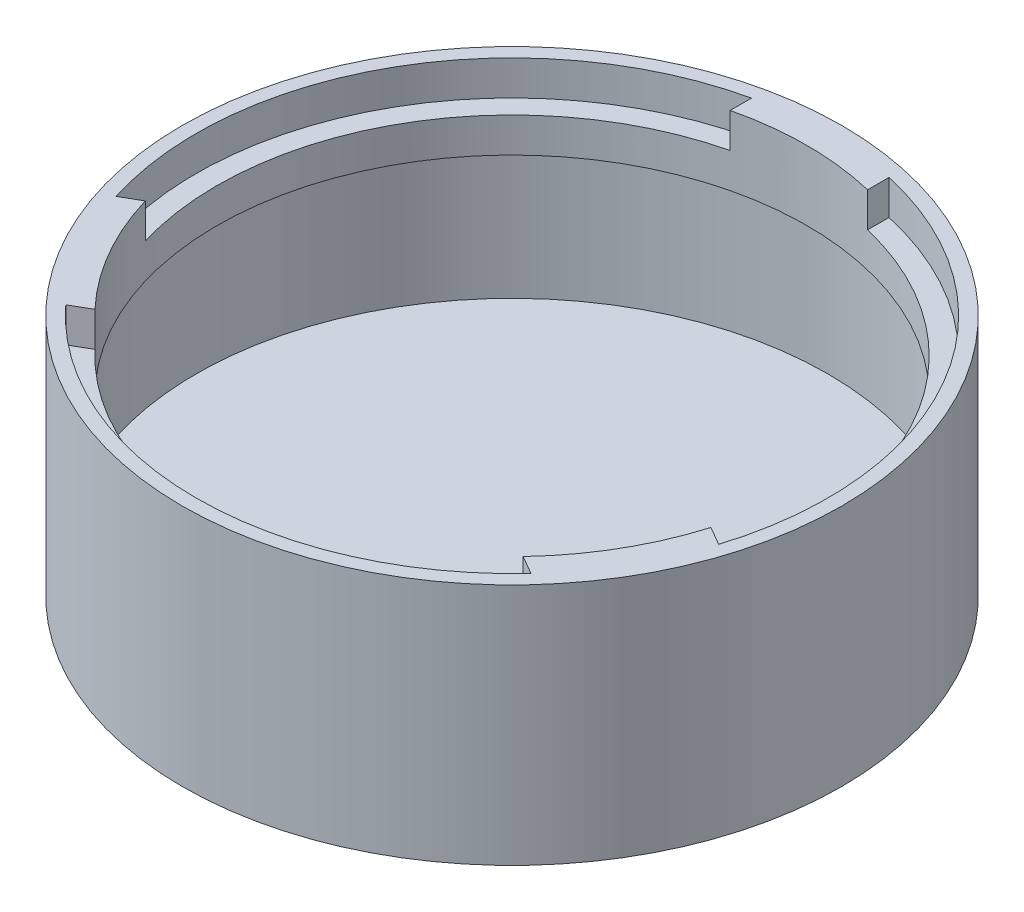
from build123d import *
from build123d.topology import SkipClean

# Parameters (mm, degrees)
CROQUIS1_R               = 95
SALIENTE_EXTRUIR1_DEPTH  = 10
CROQUIS3_R               = 95
CROQUIS3_R_2             = 91
SALIENTE_EXTRUIR2_DEPTH  = 60
SALIENTE_EXTRUIR10_DEPTH = 10
SALIENTE_EXTRUIR15_START = -10
CROQUIS7_R               = 91
CROQUIS7_R_2             = 85
SALIENTE_EXTRUIR15_DEPTH = 10


with BuildPart() as part:
    # Croquis1 → Saliente-Extruir1 (new body)
    with BuildSketch(Plane(origin=(0, 0, 0), x_dir=(1, 0, 0), z_dir=(0, 1, 0))):
        with Locations(Location((0, 0, 0), (0, 0, 270))):
            Circle(CROQUIS1_R)
    extrude(amount=SALIENTE_EXTRUIR1_DEPTH)

    # Croquis3 → Saliente-Extruir2 (add)
    with BuildSketch(Plane(origin=(0, 10, 0), x_dir=(1, 0, 0), z_dir=(0, 1, 0))):
        with Locations(Location((0, 0, 0), (0, 0, 270))):
            Circle(CROQUIS3_R)
        with Locations(Location((0, 0, 0), (0, 0, 270))):
            Circle(CROQUIS3_R_2, mode=Mode.SUBTRACT)
    extrude(amount=SALIENTE_EXTRUIR2_DEPTH)

    # Croquis4 → Saliente-Extruir10 (add)
    with BuildSketch(Plane(origin=(0, 60, 0), x_dir=(1, 0, 0), z_dir=(0, 1, 0))):
        with BuildLine():
            Line((-81.487149685, -24.183557146), (-86.820218408, -27.262605809))
            ThreePointArc((-86.820218408, -27.262605809), (-78.808311744, -45.5), (-67.020218408, -61.557211799))
            Line((-67.020218408, -61.557211799), (-61.687149685, -58.478163136))
            ThreePointArc((-61.687149685, -58.478163136), (-73.612159322, -42.5), (-81.487149685, -24.183557146))
        make_face()
        with BuildLine():
            Line((61.687149685, -58.478163136), (67.020218408, -61.557211799))
            ThreePointArc((67.020218408, -61.557211799), (78.808311744, -45.5), (86.820218408, -27.262605809))
            Line((86.820218408, -27.262605809), (81.487149685, -24.183557146))
            ThreePointArc((81.487149685, -24.183557146), (73.612159322, -42.5), (61.687149685, -58.478163136))
        make_face()
        with BuildLine():
            ThreePointArc((19.8, 88.819817608), (0, 91), (-19.8, 88.819817608))
            Line((-19.8, 88.819817608), (-19.8, 82.661720282))
            ThreePointArc((-19.8, 82.661720282), (0, 85), (19.8, 82.661720282))
            Line((19.8, 82.661720282), (19.8, 88.819817608))
        make_face()
    extrude(amount=SALIENTE_EXTRUIR10_DEPTH)

    # Croquis7 → Saliente-Extruir15 (add)
    with SkipClean():  # the faces are left unmerged after this step: merging them gives an invalid solid
        with BuildSketch(Plane(origin=(0, 60, 0), x_dir=(1, 0, 0), z_dir=(0, 1, 0)).offset(SALIENTE_EXTRUIR15_START)):
            with Locations(Location((0, 0, 0), (0, 0, 270))):
                Circle(CROQUIS7_R)
            with Locations(Location((0, 0, 0), (0, 0, 103.470293186))):
                Circle(CROQUIS7_R_2, mode=Mode.SUBTRACT)
        extrude(amount=SALIENTE_EXTRUIR15_DEPTH)


solid = part.part
